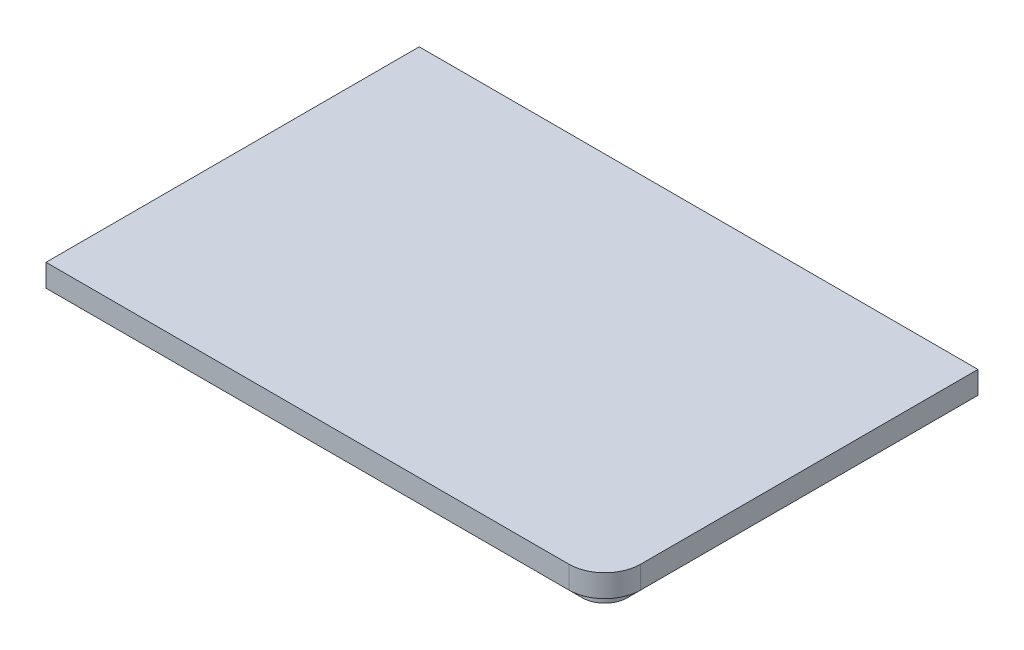
from build123d import *

# Parameters (mm, degrees)
SALIENTE_EXTRUIR1_DEPTH = 5
SALIENTE_EXTRUIR2_DEPTH = 5


with BuildPart() as part:
    # Croquis1 → Saliente-Extruir1 (new body)
    with BuildSketch(Plane(origin=(0, 0, 0), x_dir=(1, 0, 0), z_dir=(0, 1, 0))):
        with BuildLine():
            Line((-62.245, -41.575), (54.245, -41.575))
            ThreePointArc((54.245, -41.575), (59.901854249, -39.231854249), (62.245, -33.575))
            Line((62.245, -33.575), (62.245, 41.575))
            Line((62.245, 41.575), (-62.245, 41.575))
            Line((-62.245, 41.575), (-62.245, -41.575))
        make_face()
    extrude(amount=SALIENTE_EXTRUIR1_DEPTH)

    # Croquis2 → Saliente-Extruir2 (add)
    with BuildSketch(Plane(origin=(0, 0, 0), x_dir=(1, 0, 0), z_dir=(0, 1, 0))):
        with BuildLine():
            Line((52.245, -31.575), (52.245, 31.575))
            Line((52.245, 31.575), (21.4, 31.575))
            Line((21.4, 31.575), (-62.245, 31.575))
            Line((-62.245, 31.575), (-62.245, 36.575))
            Line((-62.245, 36.575), (57.245, 36.575))
            Line((57.245, 36.575), (57.245, -31.575))
            ThreePointArc((57.245, -31.575), (55.780533906, -35.110533906), (52.245, -36.575))
            Line((52.245, -36.575), (-62.245, -36.575))
            Line((-62.245, -36.575), (-62.245, -31.575))
            Line((-62.245, -31.575), (52.245, -31.575))
        make_face()
    extrude(amount=-SALIENTE_EXTRUIR2_DEPTH)


solid = part.part
